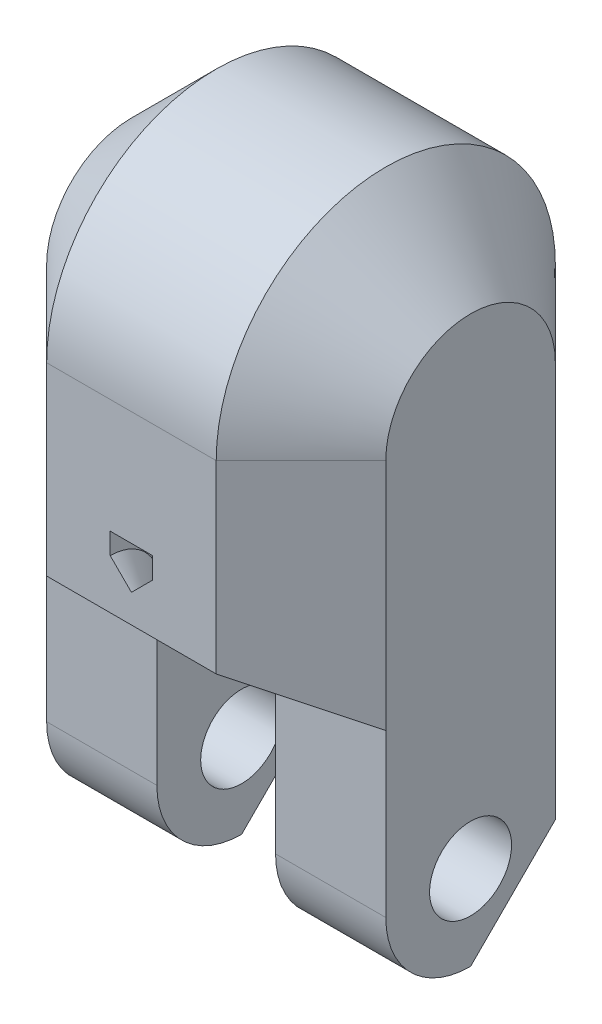
from build123d import *

# Parameters (mm, degrees)
BOSS_EXTRUDE1_DEPTH      = 5
CUT_EXTRUDE8_DEPTH       = 10.848857802
CUT_EXTRUDE8_DEPTH_BACK  = 10.848857802
REVOLVE1_ANGLE           = 180
SKETCH24_W               = 3.9
SKETCH24_H               = 6
BOSS_EXTRUDE2_DEPTH      = 4
SKETCH25_W               = 3.9
SKETCH25_H               = 3
REVOLVE2_ANGLE           = 180
SKETCH26_R               = 1.45
CUT_EXTRUDE9_DEPTH       = 19
BOSS_EXTRUDE4_DEPTH      = 3.7
CUT_EXTRUDE10_DEPTH      = 19
CUT_EXTRUDE10_DEPTH_BACK = 19


with BuildPart() as part:
    # Sketch2 → Boss-Extrude1 (new, symmetric)
    with BuildSketch(Plane(origin=(0, 0, 0), x_dir=(1, 0, 0), z_dir=(0, 1, 0))):
        Polygon((-3, 6), (3, 6), (6, 3), (6, -3), (3, -6), (-3, -6), (-6, -3), (-6, 3), align=None)
    extrude(amount=BOSS_EXTRUDE1_DEPTH, both=True)

    # Sketch22 → Cut-Extrude8 (cut, two sides: drawn at the far end of the back side and taken through both)
    with BuildSketch(Plane(origin=(0, 0, 0), x_dir=(0, 0, -1), z_dir=(1, 0, 0)).offset(-CUT_EXTRUDE8_DEPTH_BACK)):
        Polygon((0, -5), (-6, -5), (-6, -1.535898385), align=None)
    extrude(amount=CUT_EXTRUDE8_DEPTH + CUT_EXTRUDE8_DEPTH_BACK, mode=Mode.SUBTRACT)

    # Sketch23 → Revolve1 (revolve)
    with BuildSketch(Plane(origin=(0, 5, 0), x_dir=(1, 0, 0), z_dir=(0, 1, 0))):
        Polygon((-6, 0), (-6, 3), (-3, 6), (3, 6), (6, 3), (6, 0), align=None)
    revolve(axis=Axis((6, 5, 0), (1, 0, 0)), revolution_arc=REVOLVE1_ANGLE)

    # Sketch24 → Boss-Extrude2 (add, symmetric)
    with BuildSketch(Plane.XZ.offset(5)):
        with Locations((-4.05, 0)):
            Rectangle(SKETCH24_W, SKETCH24_H)
    boss_extrude2 = extrude(amount=BOSS_EXTRUDE2_DEPTH, both=True)

    # Sketch25 → Revolve2 (revolve)
    with BuildSketch(Plane.XZ.offset(9)):
        with Locations((-4.05, 1.5)):
            Rectangle(SKETCH25_W, SKETCH25_H)
    revolve2 = revolve(axis=Axis((-6, -9, 0), (1, 0, 0)), revolution_arc=REVOLVE2_ANGLE)

    # Sketch26 → Cut-Extrude9 (cut, symmetric)
    with BuildSketch(Plane.ZY.offset(6)):
        with Locations((0, -9)):
            Circle(SKETCH26_R)
    cut_extrude9 = extrude(amount=CUT_EXTRUDE9_DEPTH, both=True, mode=Mode.SUBTRACT)

    # Mirror1: Boss-Extrude2, Revolve2, Cut-Extrude9 across plane
    add(boss_extrude2.mirror(Plane(origin=(0, 0, 0), x_dir=(0, 0, 1), z_dir=(1, 0, 0))))
    add(revolve2.mirror(Plane(origin=(0, 0, 0), x_dir=(0, 0, 1), z_dir=(1, 0, 0))))
    add(cut_extrude9.mirror(Plane(origin=(0, 0, 0), x_dir=(0, 0, 1), z_dir=(1, 0, 0))), mode=Mode.SUBTRACT)

    # Sketch30 → Cut-Revolve1 (revolve, cut)
    with BuildSketch(Plane(origin=(0, -3.75, 2.165063509), x_dir=(1, 0, 0), z_dir=(0, -0.8660254037844418, 0.49999999999999484))):
        Polygon((0, 3.42820323), (-0.75, 2.67820323), (-0.75, 1.92820323), (0.75, 1.92820323), (0.75, 2.67820323), align=None)
    revolve(axis=Axis((-6, -1.535898385, 6), (1, 0, 0)), mode=Mode.SUBTRACT)

    # Sketch34 → Boss-Extrude4 (add)
    with BuildSketch(Plane.XZ.offset(5)):
        Polygon((-6, -3), (-2.1, -3), (2.1, -3), (6, -3), (3, -6), (-3, -6), align=None)
    extrude(amount=BOSS_EXTRUDE4_DEPTH)

    # Sketch35 → Cut-Revolve3 (revolve, cut)
    with BuildSketch(Plane.XZ.offset(8.7)):
        Polygon((0, -3.5), (-0.75, -4.25), (-0.75, -5), (0.75, -5), (0.75, -4.25), align=None)
    revolve(axis=Axis((3, -8.7, -6), (1, 0, 0)), mode=Mode.SUBTRACT)

    # Sketch36 → Cut-Extrude10 (cut, two sides: drawn at the far end of the back side and taken through both)
    with BuildSketch(Plane.ZY.offset(6).offset(-CUT_EXTRUDE10_DEPTH_BACK)):
        Polygon((-3, -9), (0, -12), (0, -13.528535059), (-3.643435522, -13.528535059), (-3.643435522, -9), align=None)
    extrude(amount=CUT_EXTRUDE10_DEPTH + CUT_EXTRUDE10_DEPTH_BACK, mode=Mode.SUBTRACT)


solid = part.part
